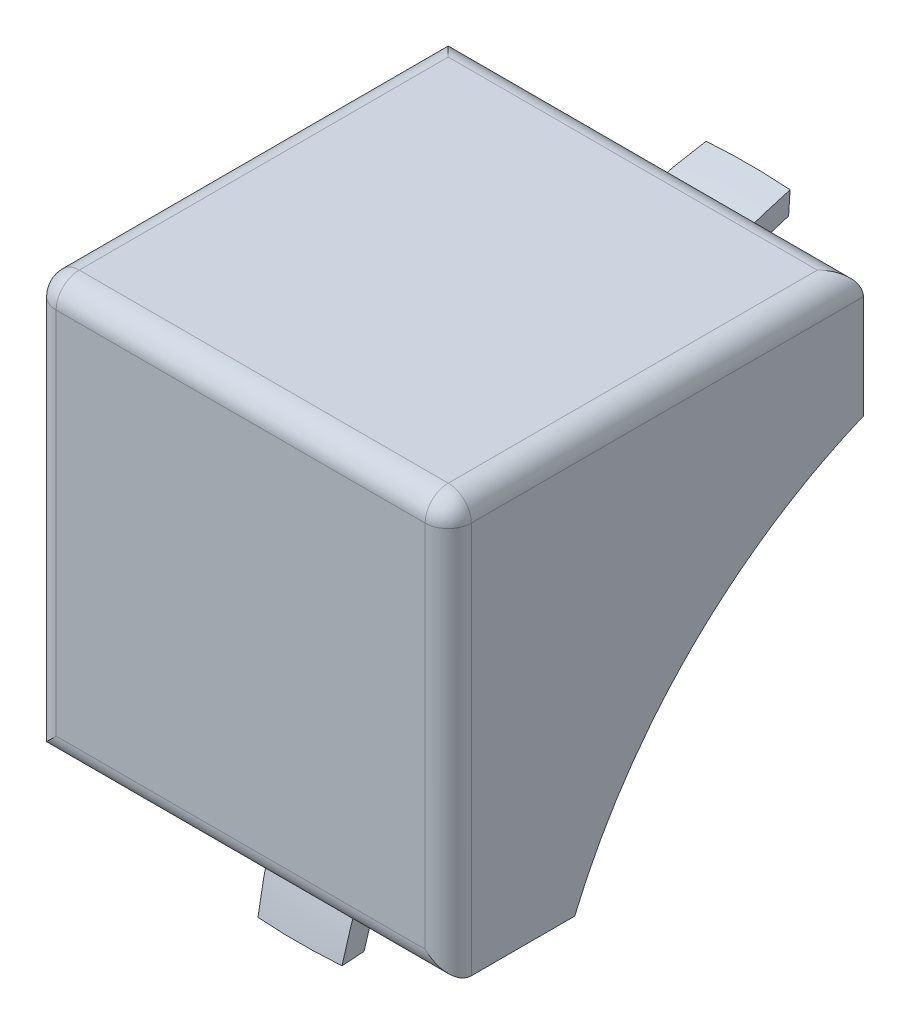
from build123d import *

# Parameters (mm, degrees)
SKETCH_1_W          = 54
SKETCH_1_H          = 54
EXTRUDE_1_DEPTH     = 27
CUT_EXTRUDE_1_DEPTH = 54
SKETCH_3_W          = 18
SKETCH_3_H          = 36
CUT_EXTRUDE_2_DEPTH = 34.674916481
REVOLVE_3_ANGLE     = 10
SKETCH_7_W          = 18.755996754
SKETCH_7_H          = 27.576886317
CUT_EXTRUDE_3_DEPTH = 36.972211497
SKETCH_8_W          = 19.05446657
SKETCH_8_H          = 22.981146603
CUT_EXTRUDE_4_DEPTH = 36.972211497
FILLET_1_R          = 1
SCALE_1_SCALE       = 2.083333333


with BuildPart() as part:
    # 草图1 → 凸台-拉伸1 (new, symmetric)
    with BuildSketch(Plane.XY):
        Rectangle(SKETCH_1_W, SKETCH_1_H)
    extrude(amount=EXTRUDE_1_DEPTH, both=True)

    # 草图2 → 切除-拉伸1 (cut)
    with BuildSketch(Plane.XY.offset(27)):
        Polygon((-9, 27), (-27, 27), (-27, -27), (27, -27), (27, 27), (9, 27), (9, 9), (-9, 9), align=None)
    extrude(amount=-CUT_EXTRUDE_1_DEPTH, mode=Mode.SUBTRACT)

    # 草图3 → 切除-拉伸2 (cut, through all)
    with BuildSketch(Plane(origin=(0, 27, 0), x_dir=(1, 0, 0), z_dir=(0, 1, 0))):
        with Locations((0, 9)):
            Rectangle(SKETCH_3_W, SKETCH_3_H)
    extrude(amount=-CUT_EXTRUDE_2_DEPTH, mode=Mode.SUBTRACT)

    # 草图4 → 切除-旋转1 (revolve, cut)
    with BuildSketch(Plane(origin=(0, 0, 0), x_dir=(0, 0, -1), z_dir=(1, 0, 0))):
        with BuildLine():
            Line((0, 25), (0, -25))
            ThreePointArc((0, -25), (-25, 0), (0, 25))
        make_face()
    revolve(axis=Axis((0, 25, 0), (0, -1, 0)), mode=Mode.SUBTRACT)

    # 圆角1
    fillet_1_edges = [part.edges().sort_by_distance(p)[0] for p in [
        (0, 27, 27),
        (-9, 18, 27),
        (9, 18, 27),
        (0, 9, 27),
        (9, 27, 18),
        (-9, 27, 18),
        (0, 27, 9),
    ]]
    fillet(fillet_1_edges, radius=FILLET_1_R)


with BuildPart() as body_2:
    # 草图5 → 旋转3 (revolve, symmetric)
    with BuildSketch(Plane(origin=(0, 0, 0), x_dir=(0, 0, -1), z_dir=(1, 0, 0))) as revolve_3_sk:
        with BuildLine():
            Line((0, 25), (0, 24))
            ThreePointArc((0, 24), (-16.970562748, 16.970562748), (-24, 0))
            Line((-24, 0), (-25, 0))
            ThreePointArc((-25, 0), (-17.67766953, 17.67766953), (0, 25))
        make_face()
    revolve(axis=Axis((0, 0, 0), (0, 0.7071067811865489, -0.7071067811865461)), revolution_arc=REVOLVE_3_ANGLE / 2)
    revolve(revolve_3_sk.sketch, axis=Axis((0, 0, 0), (0, -0.7071067811865489, 0.7071067811865461)), revolution_arc=REVOLVE_3_ANGLE / 2)

    # 草图7 → 切除-拉伸3 (cut, through all)
    with BuildSketch(Plane(origin=(0, 5, 0), x_dir=(1, 0, 0), z_dir=(0, 1, 0))):
        with Locations((0.092851469, -13.520739947)):
            Rectangle(SKETCH_7_W, SKETCH_7_H)
    extrude(amount=-CUT_EXTRUDE_3_DEPTH, mode=Mode.SUBTRACT)

    # 草图8 → 切除-拉伸4 (cut, through all)
    with BuildSketch(Plane.XY.offset(5)):
        with Locations((-0.012585513, 15.886730384)):
            Rectangle(SKETCH_8_W, SKETCH_8_H)
    extrude(amount=-CUT_EXTRUDE_4_DEPTH, mode=Mode.SUBTRACT)


with BuildPart() as body_2_1:
    # 缩放比例1: scaled about (0, 0, 0)
    add(body_2.part.scale(SCALE_1_SCALE))


with BuildPart() as part_1:
    # 缩放比例1: scaled about (0, 0, 0)
    add(part.part.scale(SCALE_1_SCALE))


solid = Compound([body_2_1.part, part_1.part])
